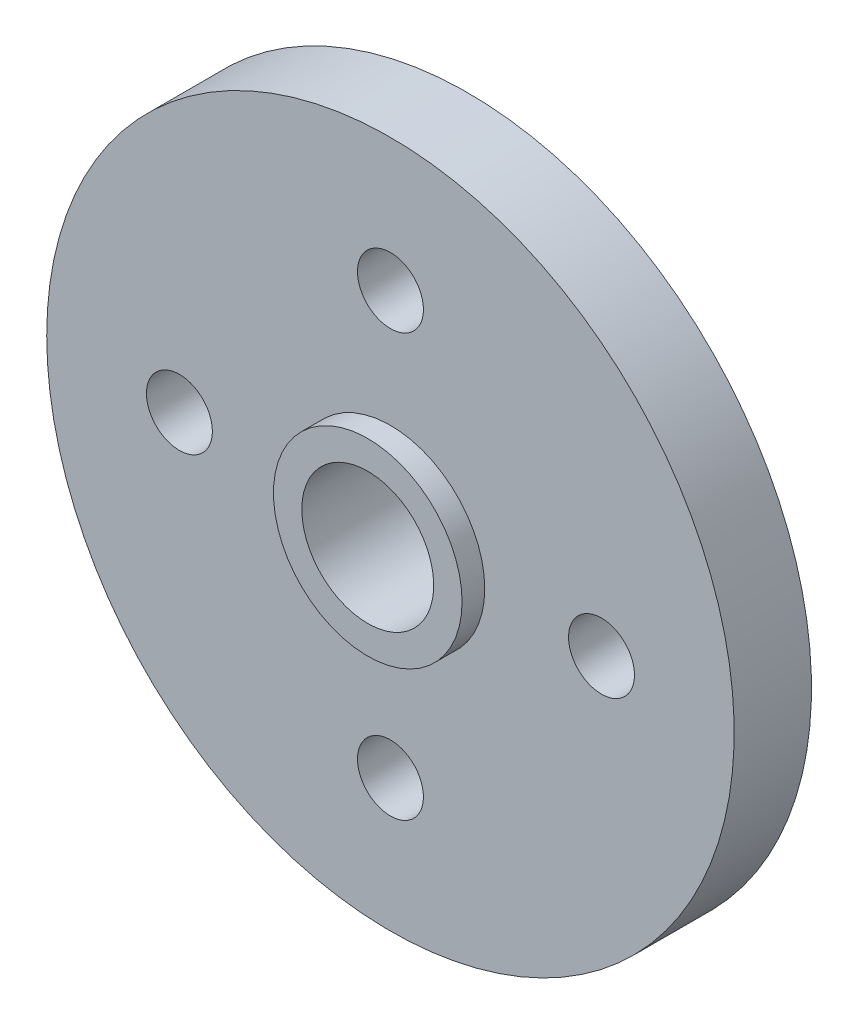
from build123d import *

# Parameters (mm, degrees)
SCHIZZO1_R                     = 13.03
ESTRUSIONE_ESTRUSIONE1_DEPTH   = 2.93
SCHIZZO2_R                     = 3.575
ESTRUSIONE_ESTRUSIONE2_DEPTH   = 0.86
SCHIZZO3_R                     = 4.725
ESTRUSIONE_ESTRUSIONE3_DEPTH   = 4.31
SCHIZZO4_R                     = 2.5
TAGLIO_ESTRUSIONE1_DEPTH       = 21.12887975
FORO_FILETTATO_M3X0_5_1_D      = 2.5
TAGLIO_ESTRUSIONE2_DEPTH       = 2.1
FORO_FILETTATO_M3X0_5_2_REACH  = 25.201
FORO_FILETTATO_M3X0_5_2_BORE_R = 1.25


with BuildPart() as part:
    # Schizzo1 → Estrusione-Estrusione1 (new body)
    with BuildSketch(Plane.XY):
        with Locations(Location((0, 0, 0), (0, 0, 180))):
            Circle(SCHIZZO1_R)
    extrude(amount=ESTRUSIONE_ESTRUSIONE1_DEPTH)

    # Schizzo2 → Estrusione-Estrusione2 (add)
    with BuildSketch(Plane.XY.offset(2.93)):
        Circle(SCHIZZO2_R)
    extrude(amount=ESTRUSIONE_ESTRUSIONE2_DEPTH)

    # Schizzo3 → Estrusione-Estrusione3 (add)
    with BuildSketch(Plane(origin=(0, 0, 0), x_dir=(-1, 0, 0), z_dir=(0, 0, -1))):
        with Locations(Location((0, 0, 0), (0, 0, 180))):
            Circle(SCHIZZO3_R)
    extrude(amount=ESTRUSIONE_ESTRUSIONE3_DEPTH)

    # Schizzo4 → Taglio-Estrusione1 (cut, through all)
    with BuildSketch(Plane(origin=(0, 0, -4.31), x_dir=(-1, 0, 0), z_dir=(0, 0, -1))):
        Circle(SCHIZZO4_R)
    extrude(amount=-TAGLIO_ESTRUSIONE1_DEPTH, mode=Mode.SUBTRACT)

    # Foro filettato M3x0.5-1 (through all)
    with Locations(Plane.XY.offset(2.93)):
        with Locations((0, 8), (0, -8), (8, 0), (-8, 0)):
            Hole(FORO_FILETTATO_M3X0_5_1_D / 2)

    # Schizzo7 → Taglio-Estrusione2 (cut)
    with BuildSketch(Plane(origin=(0, 0, 0), x_dir=(-1, 0, 0), z_dir=(0, 0, -1))):
        with BuildLine():
            Line((2.675, 9.38083152), (2.675, 5.839895119))
            ThreePointArc((2.675, 5.839895119), (2.799611887, 5.356474337), (3.142391304, 4.993533507))
            ThreePointArc((3.142391304, 4.993533507), (4.171930009, 4.171930009), (4.993533507, 3.142391304))
            ThreePointArc((4.993533507, 3.142391304), (5.356474337, 2.799611887), (5.839895119, 2.675))
            Line((5.839895119, 2.675), (9.38083152, 2.675))
            ThreePointArc((9.38083152, 2.675), (10.206895763, 3.111424037), (10.311931422, 4.039764268))
            ThreePointArc((10.311931422, 4.039764268), (7.831207602, 7.831207602), (4.039764268, 10.311931422))
            ThreePointArc((4.039764268, 10.311931422), (3.111424037, 10.206895763), (2.675, 9.38083152))
        make_face()
        with BuildLine():
            Line((-2.675, 9.38083152), (-2.675, 5.839895119))
            ThreePointArc((-2.675, 5.839895119), (-2.799611887, 5.356474337), (-3.142391304, 4.993533507))
            ThreePointArc((-3.142391304, 4.993533507), (-4.171930009, 4.171930009), (-4.993533507, 3.142391304))
            ThreePointArc((-4.993533507, 3.142391304), (-5.356474337, 2.799611887), (-5.839895119, 2.675))
            Line((-5.839895119, 2.675), (-9.38083152, 2.675))
            ThreePointArc((-9.38083152, 2.675), (-10.206895763, 3.111424037), (-10.311931422, 4.039764268))
            ThreePointArc((-10.311931422, 4.039764268), (-7.831207602, 7.831207602), (-4.039764268, 10.311931422))
            ThreePointArc((-4.039764268, 10.311931422), (-3.111424037, 10.206895763), (-2.675, 9.38083152))
        make_face()
        with BuildLine():
            Line((9.38083152, -2.675), (5.839895119, -2.675))
            ThreePointArc((5.839895119, -2.675), (5.356474337, -2.799611887), (4.993533507, -3.142391304))
            ThreePointArc((4.993533507, -3.142391304), (4.171930009, -4.171930009), (3.142391304, -4.993533507))
            ThreePointArc((3.142391304, -4.993533507), (2.799611887, -5.356474337), (2.675, -5.839895119))
            Line((2.675, -5.839895119), (2.675, -9.38083152))
            ThreePointArc((2.675, -9.38083152), (3.111424037, -10.206895763), (4.039764268, -10.311931422))
            ThreePointArc((4.039764268, -10.311931422), (7.831207602, -7.831207602), (10.311931422, -4.039764268))
            ThreePointArc((10.311931422, -4.039764268), (10.206895763, -3.111424037), (9.38083152, -2.675))
        make_face()
        with BuildLine():
            Line((-2.675, -9.38083152), (-2.675, -5.839895119))
            ThreePointArc((-2.675, -5.839895119), (-2.799611887, -5.356474337), (-3.142391304, -4.993533507))
            ThreePointArc((-3.142391304, -4.993533507), (-4.171930009, -4.171930009), (-4.993533507, -3.142391304))
            ThreePointArc((-4.993533507, -3.142391304), (-5.356474337, -2.799611887), (-5.839895119, -2.675))
            Line((-5.839895119, -2.675), (-9.38083152, -2.675))
            ThreePointArc((-9.38083152, -2.675), (-10.206895763, -3.111424037), (-10.311931422, -4.039764268))
            ThreePointArc((-10.311931422, -4.039764268), (-7.831207602, -7.831207602), (-4.039764268, -10.311931422))
            ThreePointArc((-4.039764268, -10.311931422), (-3.111424037, -10.206895763), (-2.675, -9.38083152))
        make_face()
    extrude(amount=-TAGLIO_ESTRUSIONE2_DEPTH, mode=Mode.SUBTRACT)

    # Foro filettato M3x0.5-2 bore → Foro filettato M3x0.5-2 (cut, up to next)
    with BuildSketch(Plane(origin=(4.440047633, -1.616045177, 0), x_dir=(-0.3420201433256662, -0.9396926207859093, 0), z_dir=(0.9396926207859093, -0.3420201433256662, 0)), mode=Mode.PRIVATE) as foro_filettato_m3x0_5_2_sk1:
        with Locations((0, 2.155)):
            Circle(FORO_FILETTATO_M3X0_5_2_BORE_R)
    foro_filettato_m3x0_5_2_tool1 = extrude(foro_filettato_m3x0_5_2_sk1.sketch, amount=-FORO_FILETTATO_M3X0_5_2_REACH, mode=Mode.PRIVATE) & part.part
    add(foro_filettato_m3x0_5_2_tool1.solids().sort_by_distance((4.440048, -1.616045, -2.155))[0], mode=Mode.SUBTRACT)


solid = part.part
